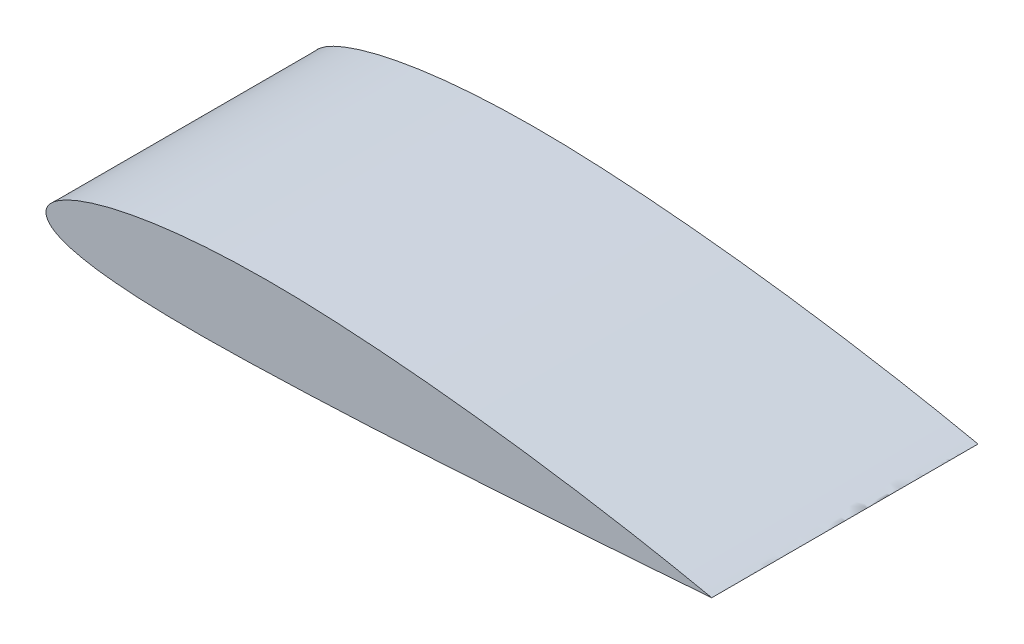
from build123d import *

# Parameters (mm, degrees)
BOSS_EXTRUDE1_DEPTH = 30


with BuildPart() as part:
    # Sketch4 → Boss-Extrude1 (new body)
    with BuildSketch(Plane.XY):
        with BuildLine():
            add(Edge.make_bspline(
                [(75, 0), (75.000368965, 0.005590272), (74.754269298, 0.044395665), (74.502486262, 0.111131935), (73.883304271, 0.234072143), (73.115234185, 0.396993751), (72.09802843, 0.603568089), (70.880414023, 0.847362856), (69.453629283, 1.124972303), (67.831593002, 1.431504893), (66.022015182, 1.761844506), (64.036221638, 2.110623448), (61.885917627, 2.47265702), (59.584013788, 2.842212754), (57.144431999, 3.213866648), (54.581949121, 3.582337799), (51.912150914, 3.942001605), (49.151345686, 4.287796232), (46.316533826, 4.614371594), (43.425172631, 4.916731066), (40.49520093, 5.189898807), (37.544839116, 5.429120002), (34.592537121, 5.629831341), (31.653461601, 5.787972493), (28.741692735, 5.9013581), (25.875192807, 5.949270454), (23.076242414, 5.931644643), (20.367610784, 5.847791495), (17.767197406, 5.699040105), (15.292205525, 5.487521793), (12.958894713, 5.217001519), (10.782478667, 4.891947817), (8.77692625, 4.518269401), (6.954871163, 4.10238721), (5.327424112, 3.651504704), (3.904146374, 3.172753485), (2.692577166, 2.67369989), (1.698363777, 2.160995595), (0.92398559, 1.639727866), (0.369883305, 1.110984896), (0.036414203, 0.564253171), (-0.042760245, -0.004282813), (0.147182436, -0.545399651), (0.578828482, -1.015836682), (1.219274333, -1.427756064), (2.068310761, -1.794541996), (3.12451716, -2.118066848), (4.38347157, -2.398694727), (5.838290469, -2.635714667), (7.480413215, -2.828901993), (9.299985174, -2.978618237), (11.286166736, -3.085907377), (13.427244841, -3.152903267), (15.710758228, -3.181793689), (18.12354738, -3.176381668), (20.651802848, -3.140385253), (23.281127778, -3.07852095), (25.996551367, -2.995742408), (28.786927275, -2.896688109), (31.639515859, -2.787842401), (34.536785166, -2.656390558), (37.456939147, -2.508136139), (40.378986409, -2.346984302), (43.285154281, -2.176702588), (46.157731133, -2.000835976), (48.979123561, -1.822418135), (51.731907194, -1.643686791), (54.399098761, -1.467455855), (56.964050729, -1.294971773), (59.410826554, -1.128356947), (61.724041127, -0.968633871), (63.889147858, -0.817253335), (65.892393377, -0.675433346), (67.72118946, -0.544086361), (69.363300276, -0.424604567), (70.809982382, -0.318065007), (72.046437759, -0.225191201), (73.080473822, -0.148318958), (73.86258121, -0.085530056), (74.492227013, -0.044323858), (74.750543504, -0.011447152), (74.999630973, -0.005591219), (75, 0)],
                knots=[0, 0, 0, 0, 0.000764398, 0.003053627, 0.006852719, 0.0121373, 0.018875036, 0.027022734, 0.03652937, 0.047336034, 0.059374732, 0.072570805, 0.086842635, 0.102101326, 0.118252658, 0.135196036, 0.152827755, 0.171037897, 0.189714525, 0.208740931, 0.228000542, 0.247373574, 0.266740076, 0.28598113, 0.305044922, 0.323834703, 0.342151577, 0.359885005, 0.376928716, 0.393182464, 0.40855119, 0.422947487, 0.436292855, 0.448515764, 0.45955687, 0.469369557, 0.477922568, 0.485208303, 0.491254683, 0.496154305, 0.500119334, 0.503572697, 0.507025604, 0.510984498, 0.515859934, 0.521855235, 0.529053235, 0.537475869, 0.547110754, 0.557923557, 0.569866129, 0.582879084, 0.596894467, 0.611837126, 0.627624939, 0.644170634, 0.661381165, 0.679159007, 0.697402435, 0.716091604, 0.735094519, 0.754230968, 0.773384114, 0.792437478, 0.811273507, 0.829776209, 0.847831696, 0.865326528, 0.882152483, 0.898204196, 0.913380924, 0.927586776, 0.94073179, 0.952732424, 0.963511382, 0.972999776, 0.981136009, 0.987867232, 0.993149045, 0.996946398, 0.999235472, 1, 1, 1, 1], degree=3))
        make_face()
    extrude(amount=BOSS_EXTRUDE1_DEPTH)


solid = part.part
